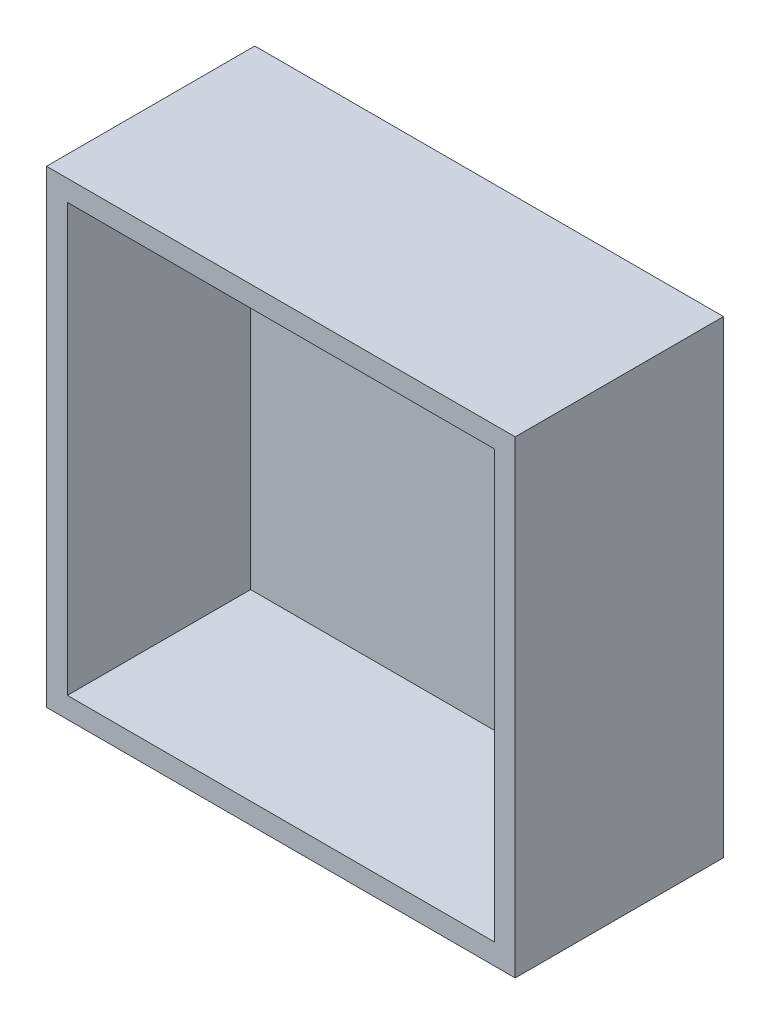
from build123d import *

# Parameters (mm, degrees)
SKETCH_1_W          = 45
SKETCH_1_H          = 45
EXTRUDE_1_DEPTH     = 20
SKETCH_2_W          = 41
SKETCH_2_H          = 41
CUT_EXTRUDE_1_DEPTH = 17
CUT_EXTRUDE_1_DRAFT = -2


with BuildPart() as part:
    # Эскиз1 → Бобышка-Вытянуть1 (new body)
    with BuildSketch(Plane.XY):
        Rectangle(SKETCH_1_W, SKETCH_1_H)
    extrude(amount=EXTRUDE_1_DEPTH)


with BuildPart() as cut_extrude_1_tool:
    # Эскиз2 → Вырез-Вытянуть1 (with draft: the straight prism first)
    with BuildSketch(Plane.XY.offset(20)):
        Rectangle(SKETCH_2_W, SKETCH_2_H)
    extrude(amount=-CUT_EXTRUDE_1_DEPTH)
    # Вырез-Вытянуть1: the draft: its side faces are tilted about the plane it starts from
    cut_extrude_1_sides = [cut_extrude_1_tool.faces().sort_by_distance(p)[0] for p in [
        (-20.5, 0, 11.5),
        (0, -20.5, 11.5),
        (20.5, 0, 11.5),
        (0, 20.5, 11.5),
    ]]
    draft(cut_extrude_1_sides, Plane.XY.offset(20), CUT_EXTRUDE_1_DRAFT)


with BuildPart() as part_1:
    add(part.part)

    # Вырез-Вытянуть1: cut by cut_extrude_1_tool
    add(cut_extrude_1_tool.part, mode=Mode.SUBTRACT)


solid = part_1.part
